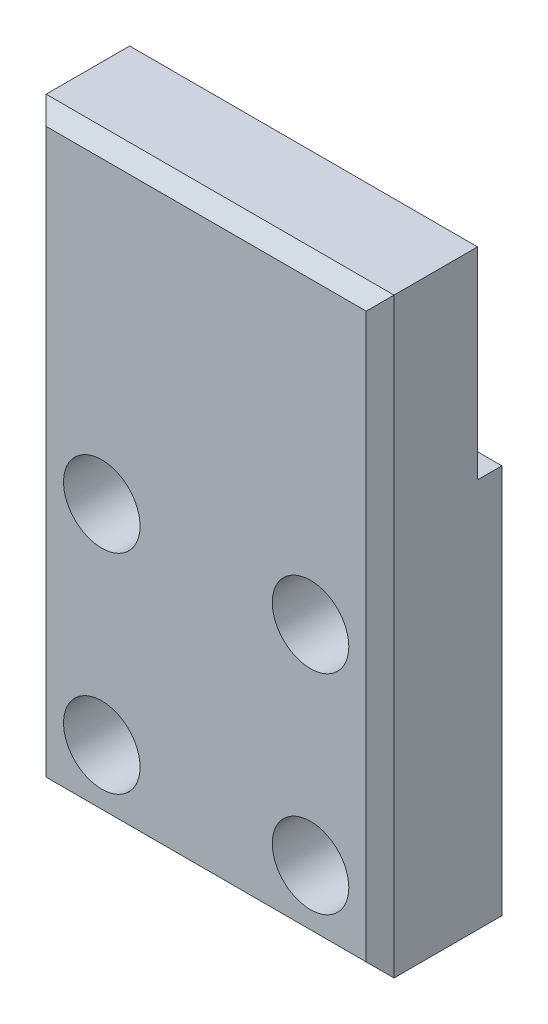
from build123d import *

# Parameters (mm, degrees)
SKETCH1_R           = 5.5
BOSS_EXTRUDE1_DEPTH = 3.5
SKETCH2_R           = 5.5
BOSS_EXTRUDE2_DEPTH = 14
CHAMFER1_SIZE       = 2


with BuildPart() as part:
    # Sketch1 → Boss-Extrude1 (new body)
    with BuildSketch(Plane.XY.offset(300)):
        Polygon((75, 66), (125, 66), (125, 60), (125, 50), (125, 10), (115, 10), (85, 10), (75, 10), (75, 50), (75, 60), align=None)
        with Locations((85, 50)):
            Circle(SKETCH1_R, mode=Mode.SUBTRACT)
        with Locations((115, 50)):
            Circle(SKETCH1_R, mode=Mode.SUBTRACT)
        with Locations((85, 20)):
            Circle(SKETCH1_R, mode=Mode.SUBTRACT)
        with Locations((115, 20)):
            Circle(SKETCH1_R, mode=Mode.SUBTRACT)
    extrude(amount=BOSS_EXTRUDE1_DEPTH)

    # Sketch2 → Boss-Extrude2 (add)
    with BuildSketch(Plane.XY.offset(303.5)):
        Polygon((75, 10), (75, 85), (75, 95), (125, 95), (125, 85), (125, 10), align=None)
        with Locations((85, 20)):
            Circle(SKETCH2_R, mode=Mode.SUBTRACT)
        with Locations((115, 20)):
            Circle(SKETCH2_R, mode=Mode.SUBTRACT)
        with Locations((115, 50)):
            Circle(SKETCH2_R, mode=Mode.SUBTRACT)
        with Locations((85, 50)):
            Circle(SKETCH2_R, mode=Mode.SUBTRACT)
    extrude(amount=BOSS_EXTRUDE2_DEPTH)

    # Chamfer1
    chamfer1_edges = [part.edges().sort_by_distance(p)[0] for p in [
        (100, 10, 317.5),
        (125, 52.5, 317.5),
        (100, 95, 317.5),
        (75, 52.5, 317.5),
    ]]
    chamfer(chamfer1_edges, length=CHAMFER1_SIZE)


solid = part.part
